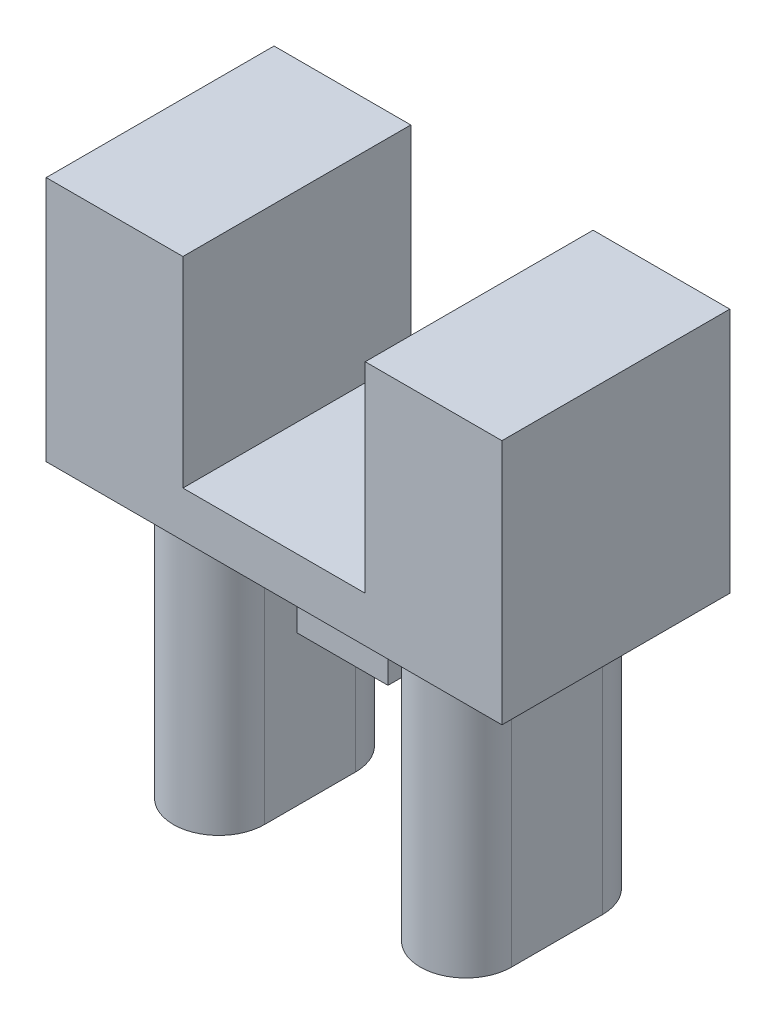
from build123d import *

# Parameters (mm, degrees)
BOSS_EXTRUDE1_DEPTH = 6.35
SKETCH2_W           = 2.54
SKETCH2_H           = 2.54
BOSS_EXTRUDE2_DEPTH = 2.54
BOSS_EXTRUDE3_DEPTH = 7.62


with BuildPart() as part:
    # Sketch1 → Boss-Extrude1 (new body)
    with BuildSketch(Plane.XY):
        Polygon((6.35, -3.429), (-6.35, -3.429), (-6.35, 3.429), (-2.54, 3.429), (-2.54, -2.159), (2.54, -2.159), (2.54, 3.429), (6.35, 3.429), align=None)
    extrude(amount=BOSS_EXTRUDE1_DEPTH)

    # Sketch2 → Boss-Extrude2 (add)
    with BuildSketch(Plane.XZ.offset(3.429)):
        with Locations((0, 3.175)):
            Rectangle(SKETCH2_W, SKETCH2_H)
    extrude(amount=BOSS_EXTRUDE2_DEPTH)

    # Sketch3 → Boss-Extrude3 (add)
    with BuildSketch(Plane.XZ.offset(3.429)):
        with BuildLine():
            Line((-4.711095298, 1.905), (-4.711095298, 4.445))
            ThreePointArc((-4.711095298, 4.445), (-3.441095298, 5.715), (-2.171095298, 4.445))
            Line((-2.171095298, 4.445), (-2.171095298, 1.905))
            ThreePointArc((-2.171095298, 1.905), (-3.441095298, 0.635), (-4.711095298, 1.905))
        make_face()
        with BuildLine():
            Line((4.711095298, 1.905), (4.711095298, 4.445))
            ThreePointArc((4.711095298, 4.445), (3.441095298, 5.715), (2.171095298, 4.445))
            Line((2.171095298, 4.445), (2.171095298, 1.905))
            ThreePointArc((2.171095298, 1.905), (3.441095298, 0.635), (4.711095298, 1.905))
        make_face()
    extrude(amount=BOSS_EXTRUDE3_DEPTH)


solid = part.part
